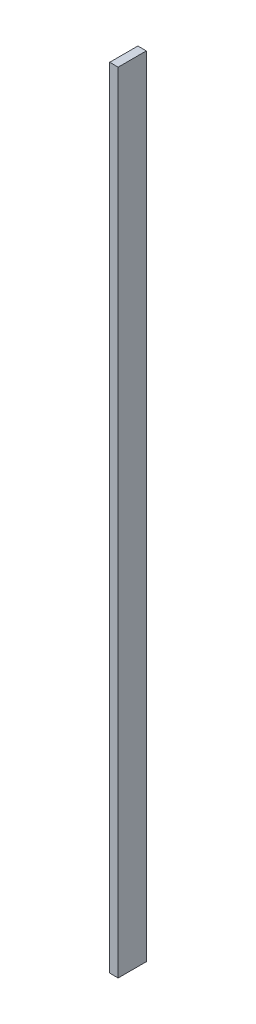
from build123d import *

# Parameters (mm, degrees)
SKETCH_1_W      = 10
SKETCH_1_H      = 280
EXTRUDE_1_DEPTH = 3


with BuildPart() as part:
    # 草图1 → 凸台-拉伸1 (new body)
    with BuildSketch(Plane(origin=(0, 0, 0), x_dir=(0, 0, -1), z_dir=(1, 0, 0))):
        with Locations((-13.075958139, -79.01341185)):
            Rectangle(SKETCH_1_W, SKETCH_1_H)
    extrude(amount=EXTRUDE_1_DEPTH)


solid = part.part
